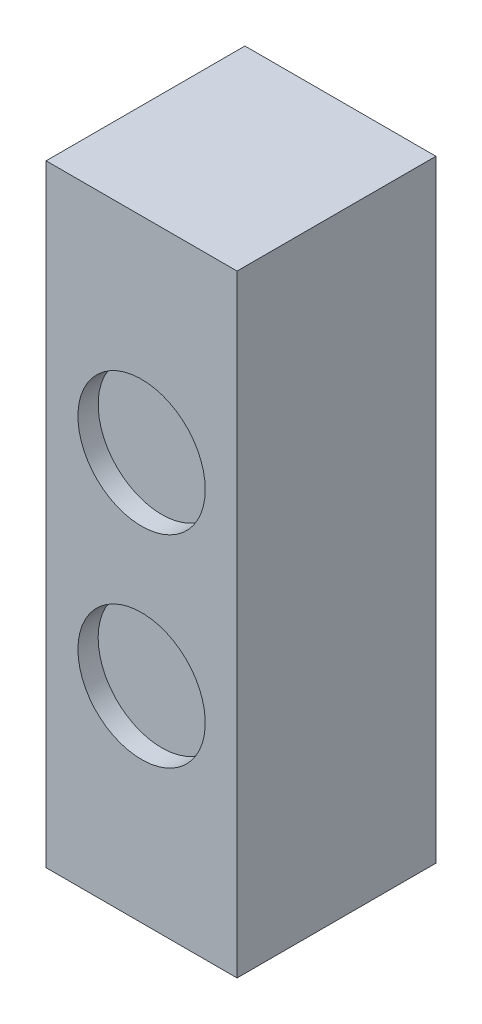
from build123d import *

# Parameters (mm, degrees)
SKETCH2_W           = 24.003
SKETCH2_H           = 76.962
BOSS_EXTRUDE1_DEPTH = 24.9936
SKETCH3_R           = 8.001
CUT_EXTRUDE1_DEPTH  = 2.54


with BuildPart() as part:
    # Sketch2 → Boss-Extrude1 (new body)
    with BuildSketch(Plane.XY):
        with Locations((12.0015, 38.481)):
            Rectangle(SKETCH2_W, SKETCH2_H)
    extrude(amount=BOSS_EXTRUDE1_DEPTH)

    # Sketch3 → Cut-Extrude1 (cut)
    with BuildSketch(Plane.XY.offset(24.9936)):
        with Locations((12.0015, 51.181)):
            Circle(SKETCH3_R)
        with Locations(Location((12.0015, 25.781, 0), (0, 0, 180))):
            Circle(SKETCH3_R)
    extrude(amount=-CUT_EXTRUDE1_DEPTH, mode=Mode.SUBTRACT)


solid = part.part
